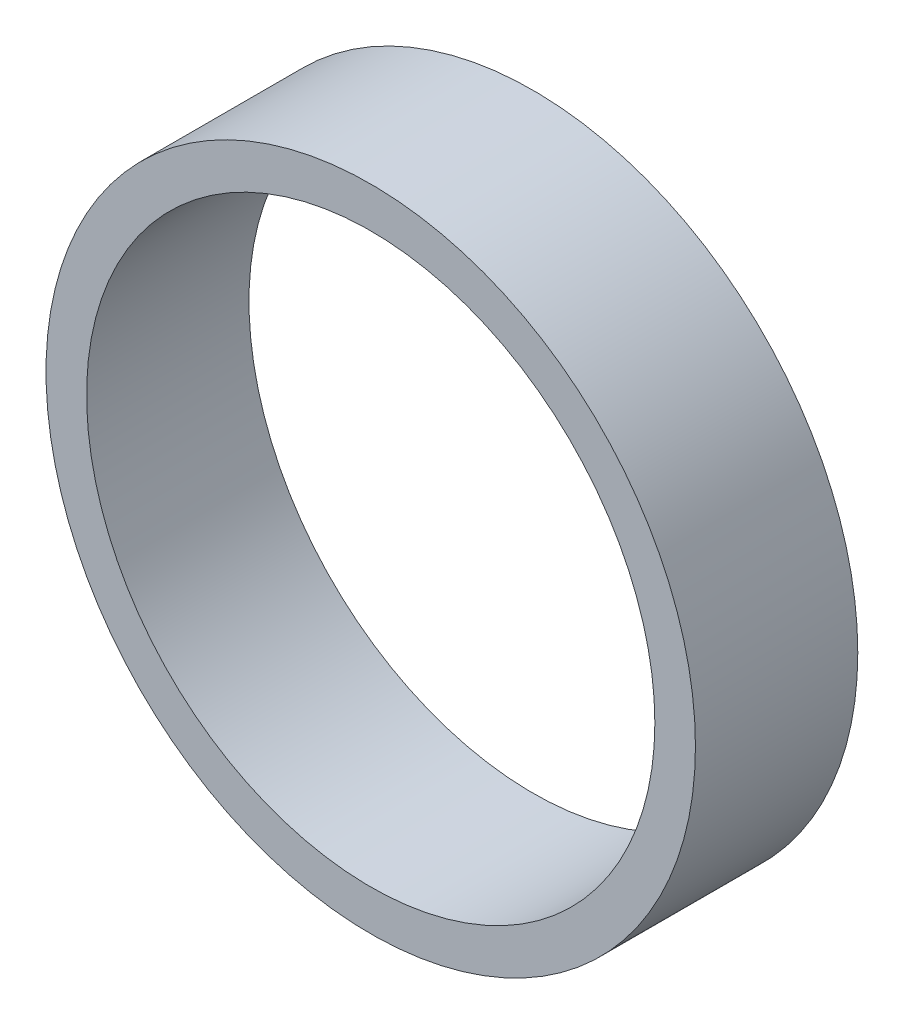
from build123d import *

# Parameters (mm, degrees)
SKETCH1_R           = 12
SKETCH1_R_2         = 10.5
BOSS_EXTRUDE1_DEPTH = 6


with BuildPart() as part:
    # Sketch1 → Boss-Extrude1 (new body)
    with BuildSketch(Plane.XY):
        Circle(SKETCH1_R)
        Circle(SKETCH1_R_2, mode=Mode.SUBTRACT)
    extrude(amount=BOSS_EXTRUDE1_DEPTH)


solid = part.part
